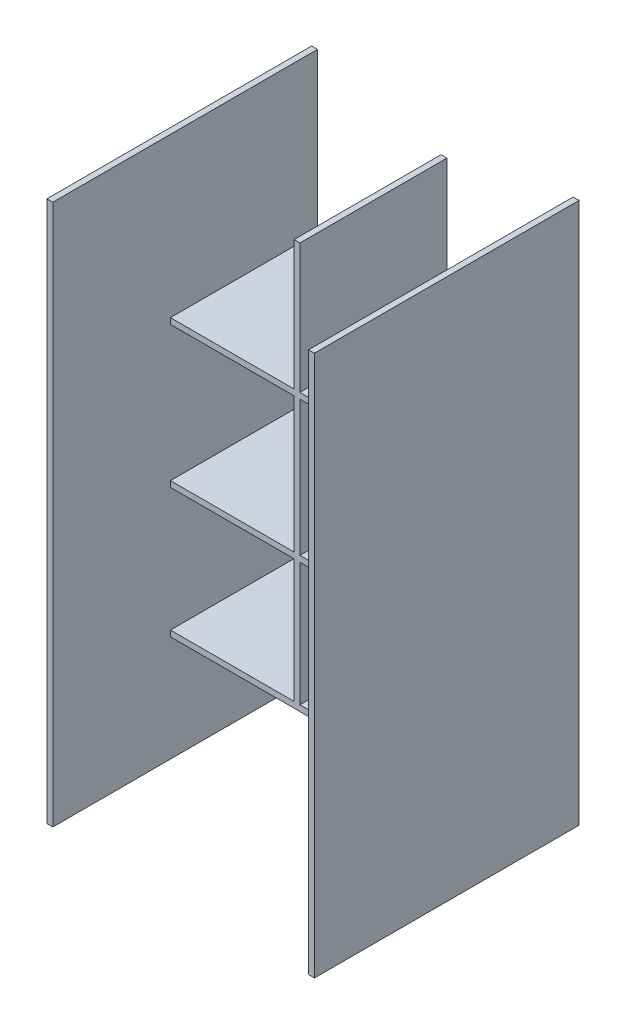
from build123d import *

# Parameters (mm, degrees)
CROQUIS1_W              = 500
CROQUIS1_H              = 690
SALIENTE_EXTRUIR1_DEPTH = 350
CROQUIS2_W              = 245
CROQUIS2_H              = 210
CROQUIS2_H_2            = 230
CROQUIS2_H_3            = 220
CORTAR_EXTRUIR5_DEPTH   = 552.38462075
CROQUIS6_R              = 2.5
CORTAR_EXTRUIR6_DEPTH   = 10
CROQUIS8_W              = 454.743369925
CROQUIS8_H              = 727.77201974
CORTAR_EXTRUIR7_DEPTH   = 100
CROQUIS10_W             = 10
CROQUIS10_H             = 230
CROQUIS10_H_2           = 210
CROQUIS10_H_3           = 220
SALIENTE_EXTRUIR2_DEPTH = 250
CROQUIS11_W             = 564.486110896
CROQUIS11_H             = 131.072073745
CORTAR_EXTRUIR8_DEPTH   = 638.102817448
CROQUIS12_W             = 20.345466795
CROQUIS12_H             = 250
CROQUIS12_W_2           = 24.91116328
CORTAR_EXTRUIR9_DEPTH   = 638.102817448
CROQUIS13_W             = 10
CROQUIS13_H             = 920
SALIENTE_EXTRUIR3_DEPTH = 250
CROQUIS15_W             = 10
CROQUIS15_H             = 920
SALIENTE_EXTRUIR4_DEPTH = 200


with BuildPart() as part:
    # Croquis1 → Saliente-Extruir1 (new body)
    with BuildSketch(Plane.XY):
        Rectangle(CROQUIS1_W, CROQUIS1_H)
    extrude(amount=-SALIENTE_EXTRUIR1_DEPTH)

    # Croquis2 → Cortar-Extruir5 (cut, through all)
    with BuildSketch(Plane.XY):
        with Locations((127.5, -230)):
            Rectangle(CROQUIS2_W, CROQUIS2_H)
        with Locations((-127.5, -230)):
            Rectangle(CROQUIS2_W, CROQUIS2_H)
        with Locations((127.5, 0)):
            Rectangle(CROQUIS2_W, CROQUIS2_H_2)
        with Locations((-127.5, 0)):
            Rectangle(CROQUIS2_W, CROQUIS2_H_2)
        with Locations((127.5, 235)):
            Rectangle(CROQUIS2_W, CROQUIS2_H_3)
        with Locations((-127.5, 235)):
            Rectangle(CROQUIS2_W, CROQUIS2_H_3)
    extrude(amount=-CORTAR_EXTRUIR5_DEPTH, mode=Mode.SUBTRACT)

    # Croquis6 → Cortar-Extruir6 (cut)
    with BuildSketch(Plane(origin=(0, 0, -350), x_dir=(-1, 0, 0), z_dir=(0, 0, -1))):
        with Locations((0, 330)):
            Circle(CROQUIS6_R)
        with Locations(Location((0, -330, 0), (0, 0, 180))):
            Circle(CROQUIS6_R)
    extrude(amount=-CORTAR_EXTRUIR6_DEPTH, mode=Mode.SUBTRACT)

    # Croquis8 → Cortar-Extruir7 (cut)
    with BuildSketch(Plane.XY):
        with Locations((2.282848242, -2.282848243)):
            Rectangle(CROQUIS8_W, CROQUIS8_H)
    extrude(amount=-CORTAR_EXTRUIR7_DEPTH, mode=Mode.SUBTRACT)

    # Croquis10 → Saliente-Extruir2 (add)
    with BuildSketch(Plane.XY.offset(-100)):
        Polygon((219.654533205, 345.243801015), (219.654533205, 125), (229.654533205, 125), (229.654533205, 345.045421076), align=None)
        with Locations((224.654533205, 0)):
            Rectangle(CROQUIS10_W, CROQUIS10_H)
        with Locations((224.654533205, -230)):
            Rectangle(CROQUIS10_W, CROQUIS10_H_2)
        with Locations((-220.08883672, -230)):
            Rectangle(CROQUIS10_W, CROQUIS10_H_2)
        with Locations((-220.08883672, 0)):
            Rectangle(CROQUIS10_W, CROQUIS10_H)
        with Locations((-220.08883672, 235)):
            Rectangle(CROQUIS10_W, CROQUIS10_H_3)
    extrude(amount=-SALIENTE_EXTRUIR2_DEPTH)

    # Croquis11 → Cortar-Extruir8 (cut, through all)
    with BuildSketch(Plane(origin=(0, 125, 0), x_dir=(1, 0, 0), z_dir=(0, 1, 0))):
        with Locations((-2.812204357, 34.463963128)):
            Rectangle(CROQUIS11_W, CROQUIS11_H)
    extrude(amount=-CORTAR_EXTRUIR8_DEPTH, mode=Mode.SUBTRACT)

    # Croquis12 → Cortar-Extruir9 (cut, through all)
    with BuildSketch(Plane(origin=(0, 125, 0), x_dir=(1, 0, 0), z_dir=(0, 1, 0))):
        with Locations((239.827266603, 225)):
            Rectangle(CROQUIS12_W, CROQUIS12_H)
        with Locations((-237.54441836, 225)):
            Rectangle(CROQUIS12_W_2, CROQUIS12_H)
    extrude(amount=-CORTAR_EXTRUIR9_DEPTH, mode=Mode.SUBTRACT)

    # Croquis13 → Saliente-Extruir3 (add)
    with BuildSketch(Plane.XY.offset(-100)):
        with Locations((224.654533205, -65)):
            Rectangle(CROQUIS13_W, CROQUIS13_H)
        with Locations((-220.08883672, -65)):
            Rectangle(CROQUIS13_W, CROQUIS13_H)
    extrude(amount=-SALIENTE_EXTRUIR3_DEPTH)

    # Croquis15 → Saliente-Extruir4 (add)
    with BuildSketch(Plane.XY.offset(-100)):
        with Locations((224.654533205, -65)):
            Rectangle(CROQUIS15_W, CROQUIS15_H)
        with Locations((-220.08883672, -65)):
            Rectangle(CROQUIS15_W, CROQUIS15_H)
    extrude(amount=SALIENTE_EXTRUIR4_DEPTH)


solid = part.part
